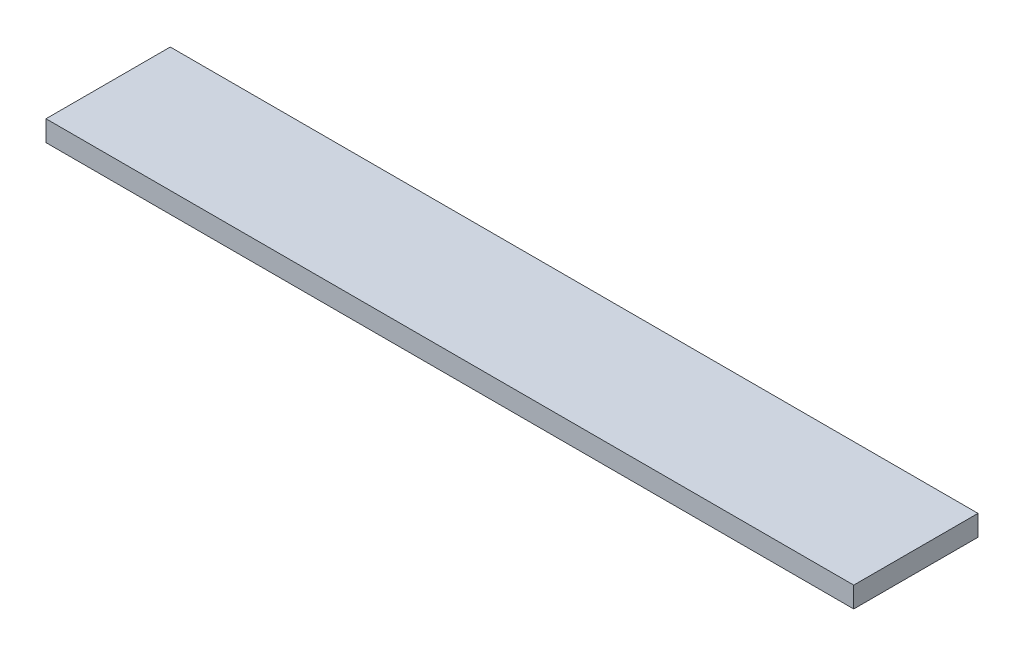
from build123d import *

# Parameters (mm, degrees)
SKETCH1_W           = 99.06
SKETCH1_H           = 15.24
BOSS_EXTRUDE1_DEPTH = 2.54


with BuildPart() as part:
    # Sketch1 → Boss-Extrude1 (new body)
    with BuildSketch(Plane(origin=(0, 0, 0), x_dir=(1, 0, 0), z_dir=(0, 1, 0))):
        with Locations((0, 4.229553571)):
            Rectangle(SKETCH1_W, SKETCH1_H)
    extrude(amount=BOSS_EXTRUDE1_DEPTH)


solid = part.part
